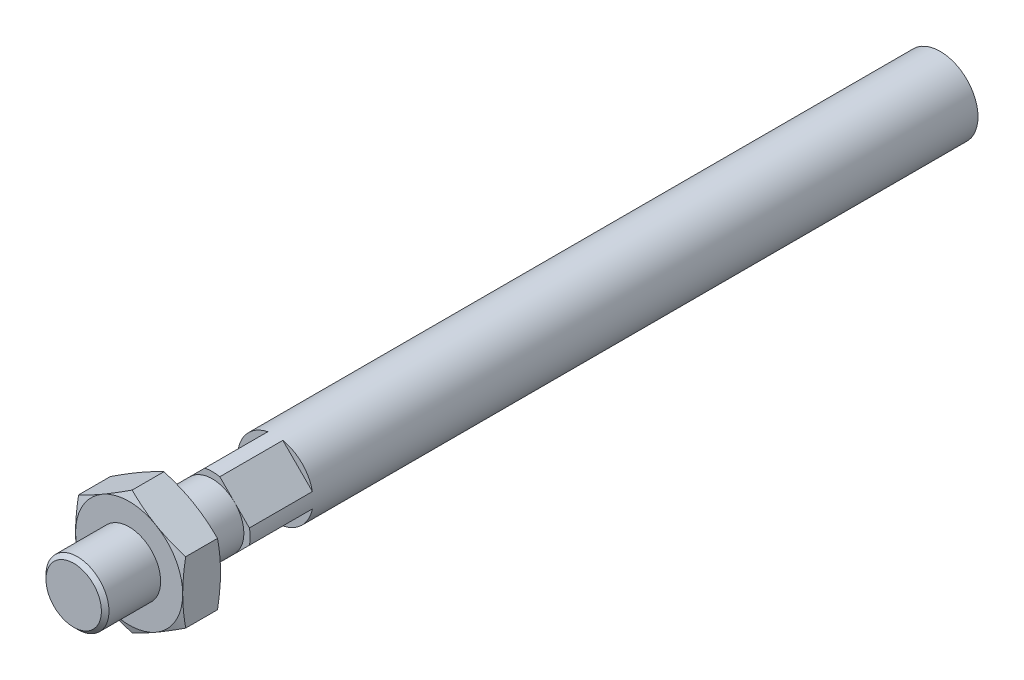
from build123d import *

# Parameters (mm, degrees)
EXTRUDE_START       = 84
SKETCH_3_R          = 6
EXTRUDE_1_DEPTH     = 115.5
SKETCH_4_R          = 5
EXTRUDE_2_DEPTH     = 22
EXTRUDE_START_2     = 91.2
EXTRUDE_3_DEPTH     = 6
SKETCH_6_OUTSIDE_W  = 46.986
SKETCH_6_OUTSIDE_H  = 49.616
CUT_EXTRUDE_1_DEPTH = 10
CHAMFER_1_SIZE      = 0.6


with BuildPart() as part:
    # 草图3 → 凸台-拉伸1 (new body)
    with BuildSketch(Plane.XY.offset(EXTRUDE_START)):
        Circle(SKETCH_3_R)
    extrude(amount=-EXTRUDE_1_DEPTH)

    # 草图4 → 凸台-拉伸2 (add)
    with BuildSketch(Plane.XY.offset(84)):
        Circle(SKETCH_4_R)
    extrude(amount=EXTRUDE_2_DEPTH)

    # 草图5 → 凸台-拉伸3 (add)
    with BuildSketch(Plane.XY.offset(EXTRUDE_START_2)):
        Polygon((0, -9.814954576), (8.5, -4.907477288), (8.5, 4.907477288), (0, 9.814954576), (-8.5, 4.907477288), (-8.5, -4.907477288), align=None)
    extrude(amount=EXTRUDE_3_DEPTH)

    # 草图7 → 切除-旋转2 (revolve, cut)
    with BuildSketch(Plane(origin=(0, 0, 0), x_dir=(0, 0, -1), z_dir=(0, 1, 0))):
        Polygon((-97.2, 8.5), (-97.2, 18.742432258), (-91.2, 18.742432258), (-91.2, 8.5), (-94.2, 16.742432258), align=None)
    revolve(axis=Axis((0, 0, 84), (0, 0, 1)), mode=Mode.SUBTRACT)

    # 草图6 outside → 切除-拉伸1 (cut)
    with BuildSketch(Plane.XY.offset(84)):
        Rectangle(SKETCH_6_OUTSIDE_W, SKETCH_6_OUTSIDE_H)
        Polygon((0, -7.071067812), (7.071067812, 0), (0, 7.071067812), (-7.071067812, 0), align=None, mode=Mode.SUBTRACT)
    extrude(amount=-CUT_EXTRUDE_1_DEPTH, mode=Mode.SUBTRACT)

    # 倒角1
    chamfer_1_edges = [part.edges().sort_by_distance(p)[0] for p in [
        (-5, 0, 106),
    ]]
    chamfer(chamfer_1_edges, length=CHAMFER_1_SIZE)


solid = part.part
